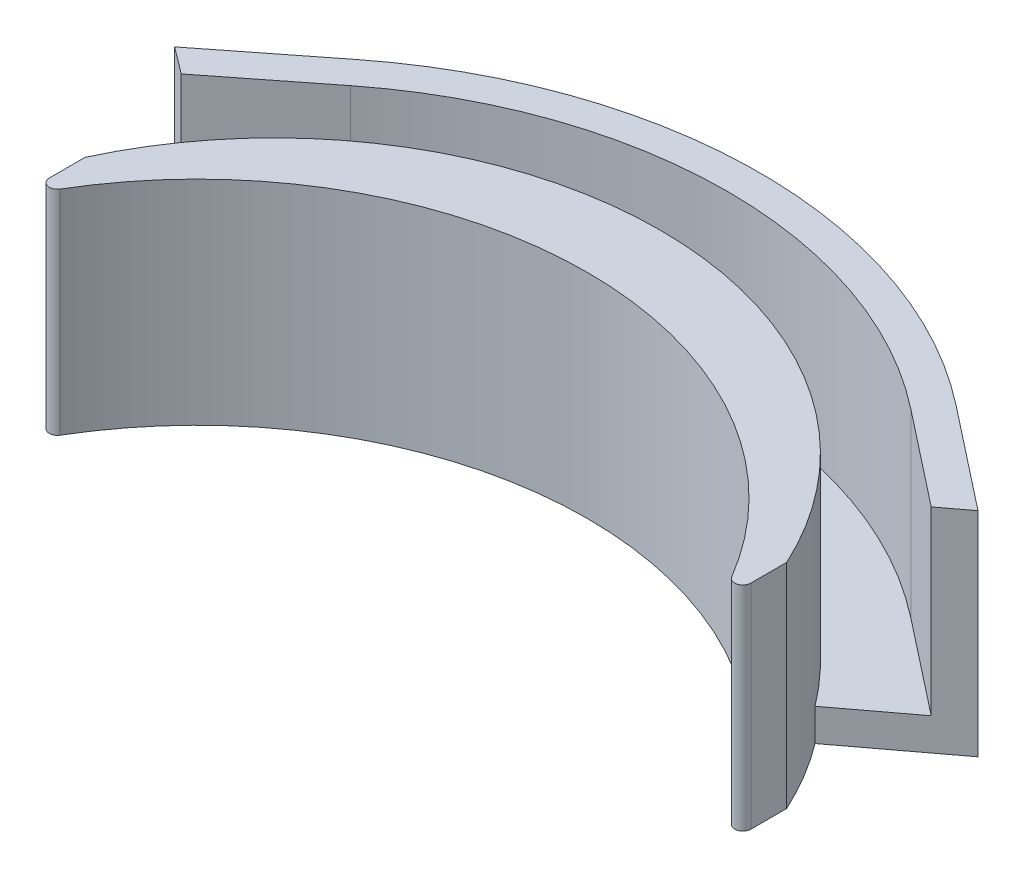
from build123d import *

# Parameters (mm, degrees)
BOSS_EXTRUDE1_DEPTH = 3.175
BOSS_EXTRUDE2_START = 17.78
BOSS_EXTRUDE2_DEPTH = 17.78
FILLET1_R           = 0.79375


with BuildPart() as part:
    # Sketch2 → Boss-Extrude1 (new body)
    with BuildSketch(Plane(origin=(0, 0, 0), x_dir=(1, 0, 0), z_dir=(0, 1, 0))):
        with BuildLine():
            ThreePointArc((0, 30.7975), (20.332846129, 24.964334619), (34.480947296, 9.239141982))
            Line((34.480947296, 9.239141982), (34.480947296, 15.906382448))
            ThreePointArc((34.480947296, 15.906382448), (32.596761403, 19.478189726), (30.343916909, 22.829705114))
            Line((30.343916909, 22.829705114), (39.484711098, 29.70691996))
            Line((39.484711098, 29.70691996), (29.497478634, 37.551994065))
            ThreePointArc((29.497478634, 37.551994065), (15.605618915, 45.130013985), (0, 47.752))
            Line((0, 47.752), (0, 30.7975))
        make_face()
    extrude(amount=-BOSS_EXTRUDE1_DEPTH)

    # Sketch2<3> → Boss-Extrude2 (add)
    with BuildSketch(Plane(origin=(0, 0, 0), x_dir=(1, 0, 0), z_dir=(0, 1, 0)).offset(BOSS_EXTRUDE2_START)):
        with BuildLine():
            Line((0, 37.973), (0, 30.7975))
            ThreePointArc((0, 30.7975), (20.332846129, 24.964334619), (34.480947296, 9.239141982))
            Line((34.480947296, 9.239141982), (34.480947296, 15.906382448))
            ThreePointArc((34.480947296, 15.906382448), (20.468703773, 31.984072518), (0, 37.973))
        make_face()
        with BuildLine():
            Line((0, 47.752), (0, 44.577))
            ThreePointArc((0, 44.577), (14.568011274, 42.129348162), (27.536210108, 35.055185949))
            Line((27.536210108, 35.055185949), (36.85939786, 27.731725813))
            Line((36.85939786, 27.731725813), (39.484711098, 29.70691996))
            Line((39.484711098, 29.70691996), (29.497478634, 37.551994065))
            ThreePointArc((29.497478634, 37.551994065), (15.605618915, 45.130013985), (0, 47.752))
        make_face()
    extrude(amount=-BOSS_EXTRUDE2_DEPTH)

    # Fillet1
    fillet1_edges = [part.edges().sort_by_distance(p)[0] for p in [
        (34.480947296, 7.3025, -9.239141982),
    ]]
    fillet(fillet1_edges, radius=FILLET1_R)

    # Mirror1: part across plane


with BuildPart() as part_1:
    add(part.part)
    add(part.part.mirror(Plane(origin=(0, -3.175, 0), x_dir=(0, 0, 1), z_dir=(1, 0, 0))))


solid = part_1.part
